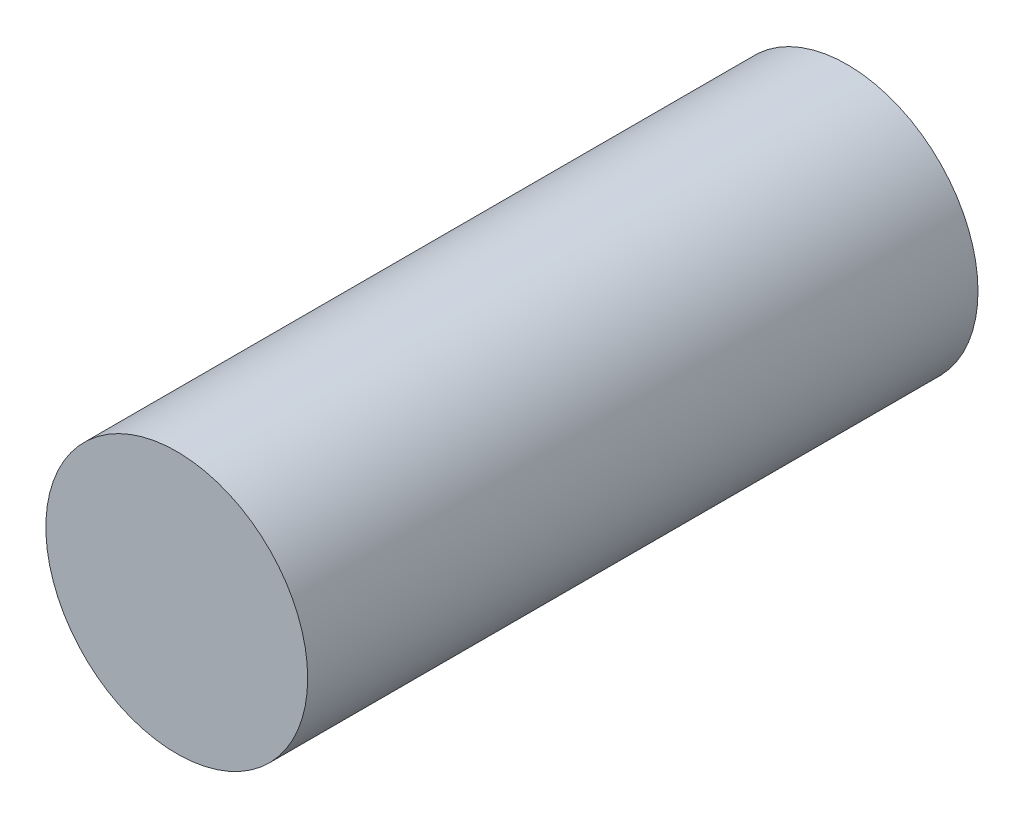
from build123d import *

# Parameters (mm, degrees)
SKETCH1_R           = 12.5
BOSS_EXTRUDE1_DEPTH = 64


with BuildPart() as part:
    # Sketch1 → Boss-Extrude1 (new body)
    with BuildSketch(Plane.XY):
        Circle(SKETCH1_R)
    extrude(amount=BOSS_EXTRUDE1_DEPTH)


solid = part.part
